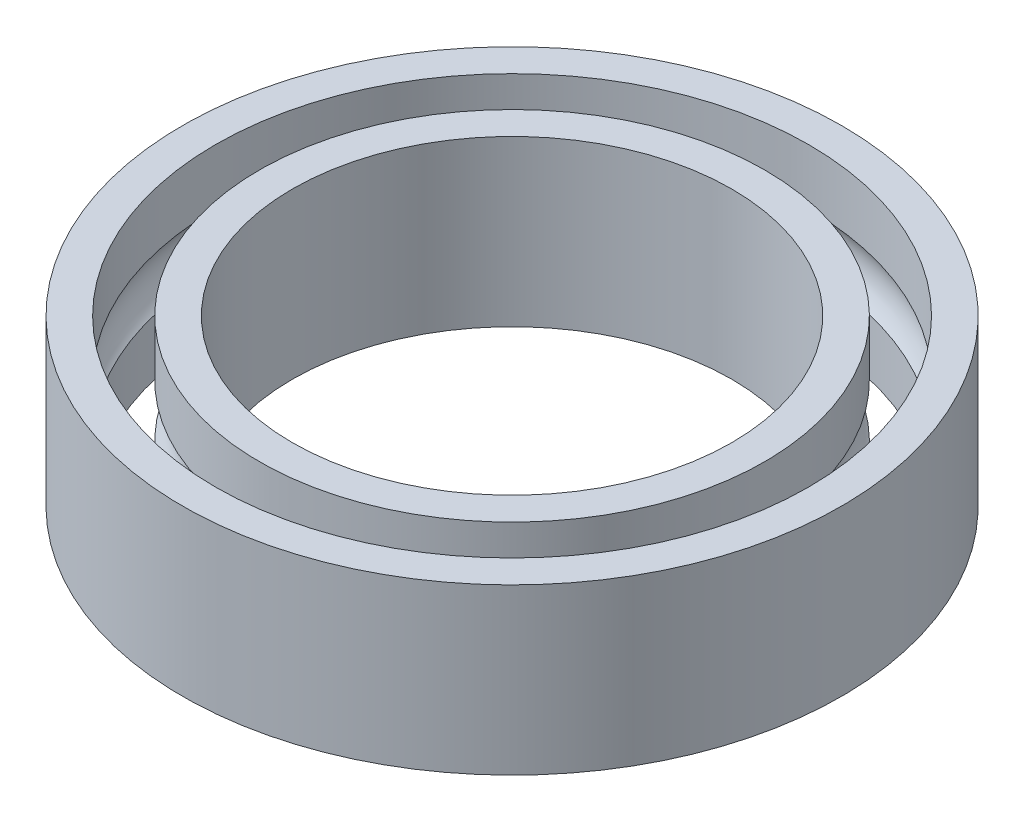
from build123d import *


with BuildPart() as part:
    # 草图1 → 旋转1 (revolve)
    with BuildSketch(Plane.XY, mode=Mode.PRIVATE) as revolve_1_sk:
        with BuildLine():
            Line((4, 1.5), (4.6, 1.5))
            Line((4.6, 1.5), (4.6, 0.480234318))
            ThreePointArc((4.6, 0.480234318), (4.375, 0), (4.6, -0.480234318))
            Line((4.6, -0.480234318), (4.6, -1.5))
            Line((4.6, -1.5), (4, -1.5))
            Line((4, -1.5), (4, 1.5))
        make_face()
        with BuildLine():
            Line((6, 1.5), (6, -1.5))
            Line((6, -1.5), (5.4, -1.5))
            Line((5.4, -1.5), (5.4, -0.480234318))
            ThreePointArc((5.4, -0.480234318), (5.625, 0), (5.4, 0.480234318))
            Line((5.4, 0.480234318), (5.4, 1.5))
            Line((5.4, 1.5), (6, 1.5))
        make_face()
    revolve(revolve_1_sk.sketch.rotate(Axis((0, -7.416987478, 0), (0, 1, 0)), 90), axis=Axis((0, -7.416987478, 0), (0, 1, 0)))


solid = part.part
